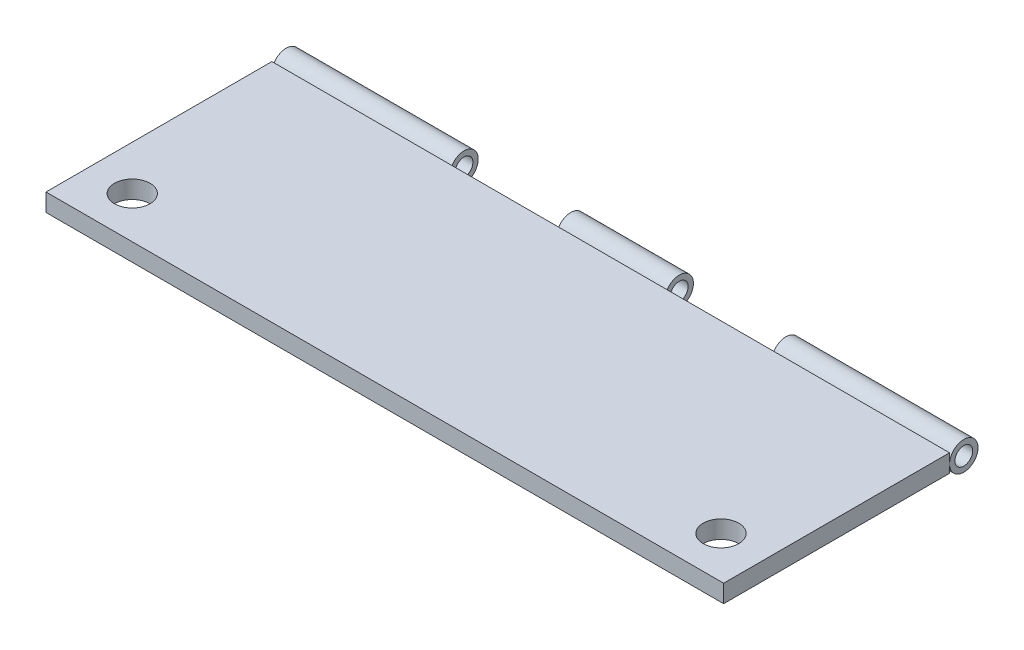
from build123d import *

# Parameters (mm, degrees)
CROQUIS1_W                        = 76.2
CROQUIS1_H                        = 25.4
SALIENTE_EXTRUIR1_DEPTH           = 2
CROQUIS2_R                        = 1.6
SALIENTE_EXTRUIR2_DEPTH           = 76.2
CROQUIS3_R                        = 2
CORTAR_EXTRUIR1_DEPTH             = 2
CROQUIS4_R                        = 1
CORTAR_EXTRUIR2_DEPTH             = 76.2
CORTAR_EXTRUIR4_REACH             = 43.375
CROQUIS5_W                        = 12
CROQUIS5_H                        = 1.6
CROQUIS5_H_2                      = 3.2
CORTAR_EXTRUIR4_DIRECTION_2_REACH = 43.375


with BuildPart() as part:
    # Croquis1 → Saliente-Extruir1 (new body)
    with BuildSketch(Plane(origin=(0, 0, 0), x_dir=(1, 0, 0), z_dir=(0, 1, 0))):
        Rectangle(CROQUIS1_W, CROQUIS1_H)
    extrude(amount=SALIENTE_EXTRUIR1_DEPTH)

    # Croquis3 → Cortar-Extruir1 (cut)
    with BuildSketch(Plane(origin=(0, 2, 0), x_dir=(1, 0, 0), z_dir=(0, 1, 0))):
        with Locations(Location((-33.1, -8, 0), (0, 0, 270))):
            Circle(CROQUIS3_R)
        with Locations(Location((33.1, -8, 0), (0, 0, 270))):
            Circle(CROQUIS3_R)
    extrude(amount=-CORTAR_EXTRUIR1_DEPTH, mode=Mode.SUBTRACT)


with BuildPart() as body_2:
    # Croquis2 → Saliente-Extruir2 (new body)
    with BuildSketch(Plane.ZY.offset(38.1)):
        with Locations((-14.306180295, 0.901009784)):
            Circle(CROQUIS2_R)
    extrude(amount=-SALIENTE_EXTRUIR2_DEPTH)

    # Croquis4 → Cortar-Extruir2 (cut)
    with BuildSketch(Plane.ZY.offset(38.1)):
        with Locations((-14.306180295, 0.901009784)):
            Circle(CROQUIS4_R)
    extrude(amount=-CORTAR_EXTRUIR2_DEPTH, mode=Mode.SUBTRACT)

    # Croquis5 → Cortar-Extruir4 (cut, up to next)
    with BuildSketch(Plane(origin=(0, 2, 0), x_dir=(1, 0, 0), z_dir=(0, 1, 0)), mode=Mode.PRIVATE) as cortar_extruir4_sk1:
        with Locations((12.1, 15.106180295)):
            Rectangle(CROQUIS5_W, CROQUIS5_H)
    cortar_extruir4_tool1 = extrude(cortar_extruir4_sk1.sketch, amount=-CORTAR_EXTRUIR4_REACH, mode=Mode.PRIVATE) & body_2.part
    # Croquis5 → Cortar-Extruir4 (cut, up to next)
    with BuildSketch(Plane(origin=(0, 2, 0), x_dir=(1, 0, 0), z_dir=(0, 1, 0)), mode=Mode.PRIVATE) as cortar_extruir4_sk2:
        with Locations((12.1, 13.506180295)):
            Rectangle(CROQUIS5_W, CROQUIS5_H)
    cortar_extruir4_tool2 = extrude(cortar_extruir4_sk2.sketch, amount=-CORTAR_EXTRUIR4_REACH, mode=Mode.PRIVATE) & body_2.part
    # Croquis5 → Cortar-Extruir4 (cut, up to next)
    with BuildSketch(Plane(origin=(0, 2, 0), x_dir=(1, 0, 0), z_dir=(0, 1, 0)), mode=Mode.PRIVATE) as cortar_extruir4_sk3:
        with Locations((-12.1, 14.306180295)):
            Rectangle(CROQUIS5_W, CROQUIS5_H_2)
    cortar_extruir4_tool3 = extrude(cortar_extruir4_sk3.sketch, amount=-CORTAR_EXTRUIR4_REACH, mode=Mode.PRIVATE) & body_2.part
    add(cortar_extruir4_tool1.solids().sort_by_distance((12.1, 2, -15.10618))[0], mode=Mode.SUBTRACT)
    add(cortar_extruir4_tool2.solids().sort_by_distance((12.1, 2, -13.50618))[0], mode=Mode.SUBTRACT)
    add(cortar_extruir4_tool3.solids().sort_by_distance((-12.1, 2, -14.30618))[0], mode=Mode.SUBTRACT)

    # Croquis5 → Cortar-Extruir4 direction 2 (cut, up to next)
    with BuildSketch(Plane(origin=(0, 2, 0), x_dir=(1, 0, 0), z_dir=(0, 1, 0)), mode=Mode.PRIVATE) as cortar_extruir4_direction_2_sk1:
        with Locations((12.1, 15.106180295)):
            Rectangle(CROQUIS5_W, CROQUIS5_H)
    cortar_extruir4_direction_2_tool1 = extrude(cortar_extruir4_direction_2_sk1.sketch, amount=CORTAR_EXTRUIR4_DIRECTION_2_REACH, mode=Mode.PRIVATE) & body_2.part
    # Croquis5 → Cortar-Extruir4 direction 2 (cut, up to next)
    with BuildSketch(Plane(origin=(0, 2, 0), x_dir=(1, 0, 0), z_dir=(0, 1, 0)), mode=Mode.PRIVATE) as cortar_extruir4_direction_2_sk2:
        with Locations((12.1, 13.506180295)):
            Rectangle(CROQUIS5_W, CROQUIS5_H)
    cortar_extruir4_direction_2_tool2 = extrude(cortar_extruir4_direction_2_sk2.sketch, amount=CORTAR_EXTRUIR4_DIRECTION_2_REACH, mode=Mode.PRIVATE) & body_2.part
    # Croquis5 → Cortar-Extruir4 direction 2 (cut, up to next)
    with BuildSketch(Plane(origin=(0, 2, 0), x_dir=(1, 0, 0), z_dir=(0, 1, 0)), mode=Mode.PRIVATE) as cortar_extruir4_direction_2_sk3:
        with Locations((-12.1, 14.306180295)):
            Rectangle(CROQUIS5_W, CROQUIS5_H_2)
    cortar_extruir4_direction_2_tool3 = extrude(cortar_extruir4_direction_2_sk3.sketch, amount=CORTAR_EXTRUIR4_DIRECTION_2_REACH, mode=Mode.PRIVATE) & body_2.part
    add(cortar_extruir4_direction_2_tool1.solids().sort_by_distance((12.1, 2, -15.10618))[0], mode=Mode.SUBTRACT)
    add(cortar_extruir4_direction_2_tool2.solids().sort_by_distance((12.1, 2, -13.50618))[0], mode=Mode.SUBTRACT)
    add(cortar_extruir4_direction_2_tool3.solids().sort_by_distance((-12.1, 2, -14.30618))[0], mode=Mode.SUBTRACT)


with BuildPart() as cortar_extruir4_piece_1:
    # of the separate pieces the step leaves, piece 1, a body of its own (cortar_extruir4_pieces)
    add(body_2.part.solids().sort_by_distance((-38.1, 0.901009784, -12.706180295))[0])


with BuildPart() as cortar_extruir4_piece_2:
    # of the separate pieces the step leaves, piece 2, a body of its own (cortar_extruir4_pieces)
    add(body_2.part.solids().sort_by_distance((18.1, 0.901009784, -12.706180295))[0])


with BuildPart() as cortar_extruir4_piece_3:
    # of the separate pieces the step leaves, piece 3, a body of its own (cortar_extruir4_pieces)
    add(body_2.part.solids().sort_by_distance((-6.1, 0.901009784, -12.706180295))[0])


solid = Compound([part.part, cortar_extruir4_piece_1.part, cortar_extruir4_piece_2.part, cortar_extruir4_piece_3.part])
